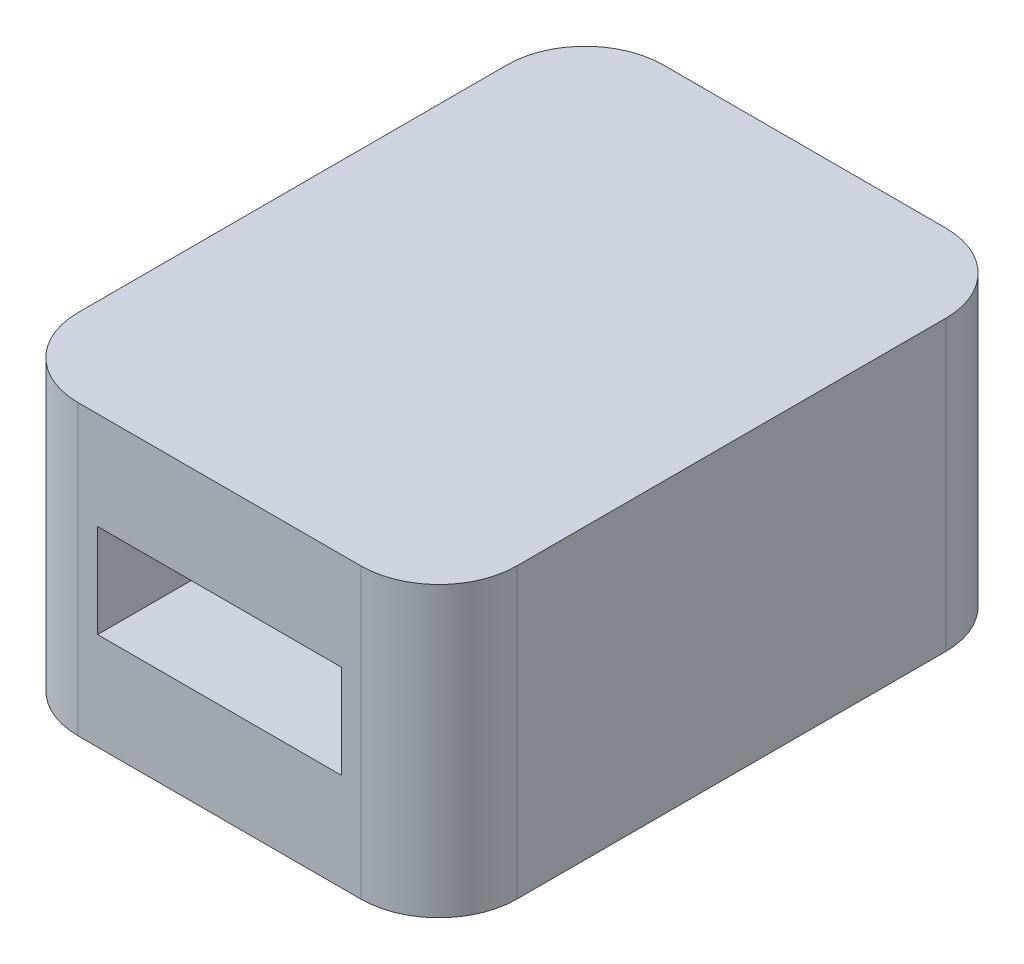
from build123d import *

# Parameters (mm, degrees)
PROFILE_SKETCH_W      = 11.25
PROFILE_SKETCH_H      = 7.4
PROFILE_SKETCH_W_2    = 6.25
PROFILE_SKETCH_H_2    = 2.4
PROFILE_EXTRUDE_DEPTH = 15
CORNER_FILLETS_R      = 2


with BuildPart() as part:
    # Profile Sketch → Profile Extrude (new body)
    with BuildSketch(Plane.XY):
        Rectangle(PROFILE_SKETCH_W, PROFILE_SKETCH_H)
        Rectangle(PROFILE_SKETCH_W_2, PROFILE_SKETCH_H_2, mode=Mode.SUBTRACT)
    extrude(amount=PROFILE_EXTRUDE_DEPTH)

    # Corner Fillets
    corner_fillets_edges = [part.edges().sort_by_distance(p)[0] for p in [
        (-5.625, 0, 15),
        (5.625, 0, 15),
        (-5.625, 0, 0),
        (5.625, 0, 0),
    ]]
    fillet(corner_fillets_edges, radius=CORNER_FILLETS_R)


solid = part.part
